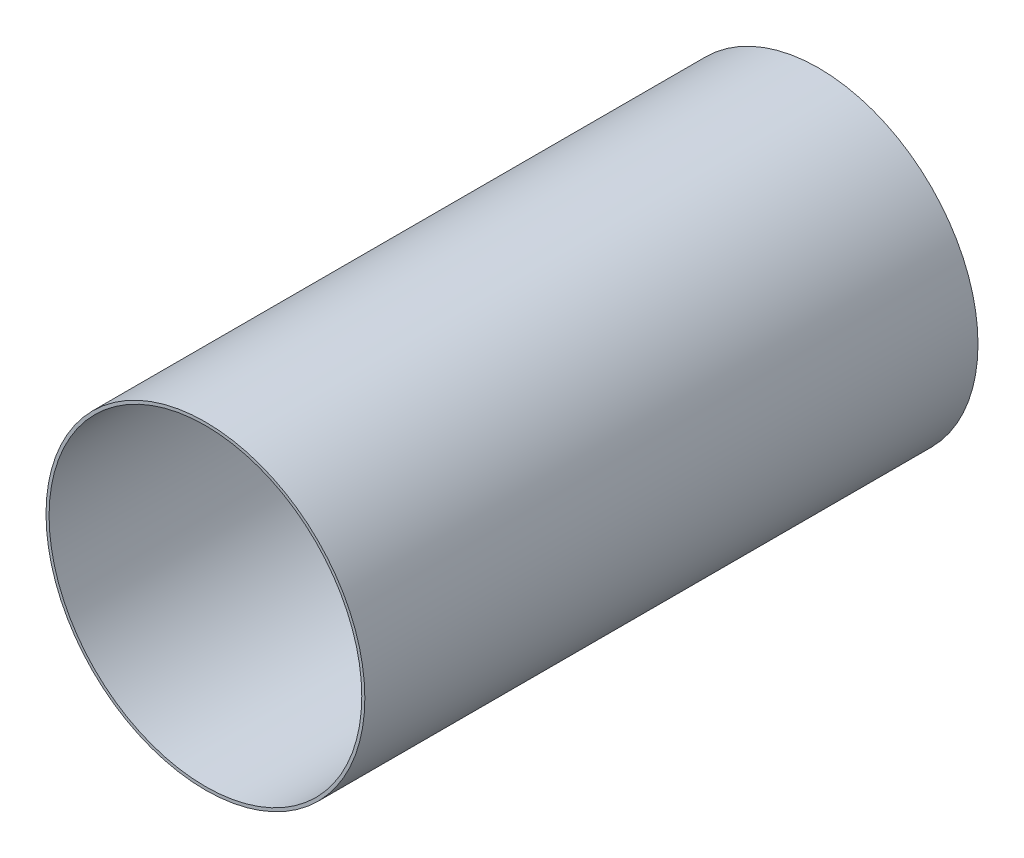
from build123d import *

# Parameters (mm, degrees)
SKETCH_1_R      = 2.6
SKETCH_1_R_2    = 2.55
EXTRUDE_1_DEPTH = 10


with BuildPart() as part:
    # 스케치1 → 보스-돌출1 (new body)
    with BuildSketch(Plane.XY):
        Circle(SKETCH_1_R)
        Circle(SKETCH_1_R_2, mode=Mode.SUBTRACT)
    extrude(amount=EXTRUDE_1_DEPTH)


solid = part.part
